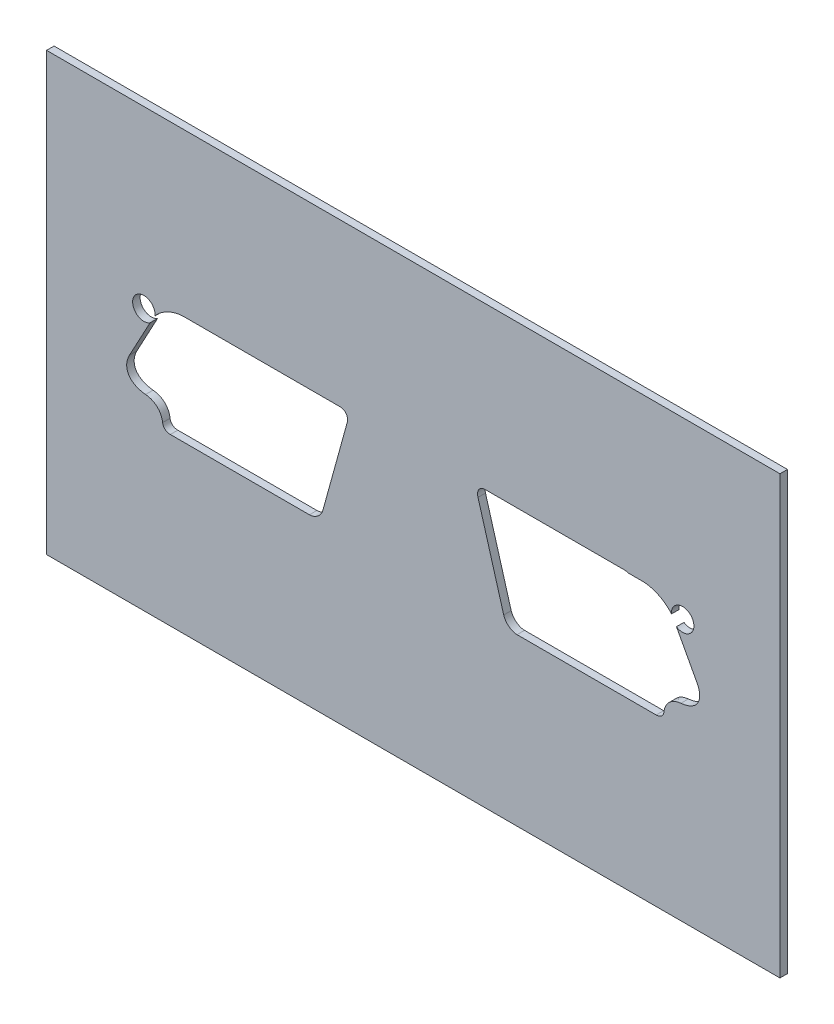
from build123d import *

# Parameters (mm, degrees)
EXTRUDE_1_DEPTH     = 1
CUT_EXTRUDE_4_DEPTH = 54.935146241
SKETCH_4_R          = 1.5
CUT_EXTRUDE_5_DEPTH = 54.935146241
CUT_EXTRUDE1_START  = -1
CUT_EXTRUDE1_DEPTH  = 1
SKETCH4_W           = 98
SKETCH4_H           = 20
BOSS_EXTRUDE1_DEPTH = 1


with BuildPart() as part:
    # Эскиз1 → Бобышка-Вытянуть1 (new body)
    with BuildSketch(Plane.XY):
        Polygon((-49, 5.839183832), (-49, -22.516660498), (49, -22.516660498), (49, 5.839183832), (49, 15.839183832), (-49, 15.839183832), align=None)
    extrude(amount=EXTRUDE_1_DEPTH)

    # Эскиз2 → Вырез-Вытянуть4 (cut, through all)
    with BuildSketch(Plane(origin=(0, 0, 0), x_dir=(-1, 0, 0), z_dir=(0, 0, -1))):
        with BuildLine():
            Line((27.226146034, -9.122134253), (15.739905482, -9.122134253))
            ThreePointArc((15.739905482, -9.122134253), (15.10500819, -9.461530461), (14.917793913, -10.156681647))
            Line((14.917793913, -10.156681647), (17.442090319, -18.930924047))
            ThreePointArc((17.442090319, -18.930924047), (18.050493328, -19.909298147), (19.122649731, -20.331021695))
            Line((19.122649731, -20.331021695), (30.826843589, -20.331021695))
            ThreePointArc((30.826843589, -20.331021695), (31.459345435, -19.990005133), (31.64325008, -19.295361367))
            Line((31.64325008, -19.295361367), (29.100959308, -10.488607797))
            ThreePointArc((29.100959308, -10.488607797), (28.40806584, -9.469896887), (27.226146034, -9.122134253))
        make_face()
        with BuildLine():
            Line((-31.64325008, -19.295361367), (-29.100959308, -10.488607797))
            ThreePointArc((-29.100959308, -10.488607797), (-28.40806584, -9.469896887), (-27.226146034, -9.122134253))
            Line((-27.226146034, -9.122134253), (-15.739905482, -9.122134253))
            ThreePointArc((-15.739905482, -9.122134253), (-15.10500819, -9.461530461), (-14.917793913, -10.156681647))
            Line((-14.917793913, -10.156681647), (-17.442090319, -18.930924047))
            ThreePointArc((-17.442090319, -18.930924047), (-18.050493328, -19.909298147), (-19.122649731, -20.331021695))
            Line((-19.122649731, -20.331021695), (-30.826843589, -20.331021695))
            ThreePointArc((-30.826843589, -20.331021695), (-31.459345435, -19.990005133), (-31.64325008, -19.295361367))
        make_face()
    extrude(amount=-CUT_EXTRUDE_4_DEPTH, mode=Mode.SUBTRACT)

    # Эскиз4 → Вырез-Вытянуть5 (cut, through all)
    with BuildSketch(Plane(origin=(0, 0, 0), x_dir=(-1, 0, 0), z_dir=(0, 0, -1))):
        with Locations((36, -7.524952718)):
            Circle(SKETCH_4_R)
        with Locations((-36, -7.524952718)):
            Circle(SKETCH_4_R)
    extrude(amount=-CUT_EXTRUDE_5_DEPTH, mode=Mode.SUBTRACT)

    # Sketch3 → Cut-Extrude1 (cut)
    with BuildSketch(Plane.XY.offset(1).offset(CUT_EXTRUDE1_START)):
        with BuildLine():
            Line((8.652344227, -7.068131311), (12.085677561, -18.961546856))
            add(Edge.make_bspline(
                [(12.085677561, -18.961546856), (12.485677561, -20.347187502), (13.871318207, -20.347187502)],
                knots=[0.857071948, 0.857071948, 0.857071948, 2.427868275, 2.427868275, 2.427868275], degree=2, weights=[1, 0.707106781, 1]))
            Line((13.871318207, -20.347187502), (32.461996875, -20.347187502))
            add(Edge.make_bspline(
                [(32.461996875, -20.347187502), (33.393769403, -20.347187502), (33.496157418, -19.484255682)],
                knots=[2.427868275, 2.427868275, 2.427868275, 3.611858299, 3.611858299, 3.611858299], degree=2, weights=[1, 0.829829079, 1]))
            add(Edge.make_bspline(
                [(33.496157418, -19.484255682), (33.529743577, -19.201189685), (33.607326061, -18.923570429), (33.853252735, -18.417152493), (34.025349409, -18.183932413), (34.436238564, -17.8036127), (34.681879478, -17.649935655), (35.200024528, -17.435065661), (35.479061866, -17.369439067), (35.76148791, -17.34207634)],
                knots=[0, 0, 0, 0, 0.25, 0.25, 0.5, 0.5, 0.75, 0.75, 1, 1, 1, 1], degree=3))
            add(Edge.make_bspline(
                [(35.76148791, -17.34207634), (36.181169226, -17.301415694), (36.592378309, -17.212108423), (37.170380488, -16.959028015), (37.354968395, -16.854344533), (37.687544868, -16.599797528), (37.83830967, -16.446579579), (38.076557482, -16.101495837), (38.166209489, -15.905573827), (38.271501218, -15.499696694), (38.288800836, -15.285469364), (38.263278752, -14.867475934), (38.220734772, -14.657932914), (38.094284502, -14.258193956), (38.010543981, -14.065974434), (37.910619322, -13.879789794)],
                knots=[0, 0, 0, 0, 0.25, 0.25, 0.375, 0.375, 0.5, 0.5, 0.625, 0.625, 0.75, 0.75, 0.875, 0.875, 1, 1, 1, 1], degree=3))
            Line((37.910619322, -13.879789794), (35.170885606, -8.774980446))
            ThreePointArc((35.170885606, -8.774980446), (34.803783463, -8.429975368), (34.571610551, -7.982886756))
            ThreePointArc((34.571610551, -7.982886756), (34.527886571, -7.812845152), (34.504331156, -7.638859302))
            add(Edge.make_bspline(
                [(34.504331156, -7.638859302), (33.03670289, -5.782259548), (30.630891119, -5.783194379)],
                knots=[4.00651056, 4.00651056, 4.00651056, 5.38030343, 5.38030343, 5.38030343], degree=2, weights=[1, 0.773217832, 1]))
            Line((30.630891119, -5.783194379), (28.778313515, -5.783914238))
            add(Edge.make_bspline(
                [(28.778313515, -5.783914238), (28.498733332, -5.682490665), (28.228663541, -5.682490665)],
                knots=[5.18447533, 5.18447533, 5.18447533, 5.569460928, 5.569460928, 5.569460928], degree=2, weights=[1, 0.981530397, 1]))
            Line((28.228663541, -5.682490665), (9.637984874, -5.682490665))
            add(Edge.make_bspline(
                [(9.637984874, -5.682490665), (8.252344227, -5.682490665), (8.652344227, -7.068131311)],
                knots=[5.569460928, 5.569460928, 5.569460928, 7.140257255, 7.140257255, 7.140257255], degree=2, weights=[1, 0.707106781, 1]))
        make_face()
        with BuildLine():
            Line((-35.170885606, -8.774980446), (-37.925052204, -13.906681863))
            add(Edge.make_bspline(
                [(-37.925052204, -13.906681863), (-38.025225081, -14.093328995), (-38.109806595, -14.28778394), (-38.235924368, -14.687324932), (-38.278394681, -14.895918794), (-38.297414091, -15.212202185), (-38.296322734, -15.317469634), (-38.277441195, -15.527644209), (-38.259343447, -15.633280004), (-38.205994928, -15.836909506), (-38.170798519, -15.935630825), (-38.082894213, -16.126717018), (-38.029532599, -16.219817403), (-37.849055501, -16.479499021), (-37.698892817, -16.631115336), (-37.362837335, -16.886481906), (-37.179664999, -16.989484869), (-36.595923377, -17.242719775), (-36.186794345, -17.329699001), (-35.766265682, -17.369273893)],
                knots=[0, 0, 0, 0, 0.125, 0.125, 0.25, 0.25, 0.3125, 0.3125, 0.375, 0.375, 0.4375, 0.4375, 0.5, 0.5, 0.625, 0.625, 0.75, 0.75, 1, 1, 1, 1], degree=3))
            add(Edge.make_bspline(
                [(-33.495182661, -19.492227082), (-33.738478544, -17.560103824), (-35.766265682, -17.369273893)],
                knots=[5.81913938, 5.81913938, 5.81913938, 6.905546226, 6.905546226, 6.905546226], degree=2, weights=[1, 0.856057288, 1]))
            add(Edge.make_bspline(
                [(-33.495182661, -19.492227082), (-33.387524752, -20.347187502), (-32.461996875, -20.347187502)],
                knots=[2.677546726, 2.677546726, 2.677546726, 3.855317033, 3.855317033, 3.855317033], degree=2, weights=[1, 0.83156042, 1]))
            Line((-32.461996875, -20.347187502), (-13.871318207, -20.347187502))
            add(Edge.make_bspline(
                [(-13.871318207, -20.347187502), (-12.46794332, -20.347187502), (-12.080702928, -18.943926093)],
                knots=[3.855317033, 3.855317033, 3.855317033, 5.438830393, 5.438830393, 5.438830393], degree=2, weights=[1, 0.702596367, 1]))
            Line((-12.080702928, -18.943926093), (-8.83075434, -7.166932971))
            add(Edge.make_bspline(
                [(-8.83075434, -7.166932971), (-8.45309236, -5.798381309), (-9.82190813, -5.798913193)],
                knots=[5.438830393, 5.438830393, 5.438830393, 6.997298301, 6.997298301, 6.997298301], degree=2, weights=[1, 0.711452073, 1]))
            Line((-9.82190813, -5.798913193), (-30.645016113, -5.807004464))
            add(Edge.make_bspline(
                [(-30.645016113, -5.807004464), (-33.032902471, -5.807932329), (-34.505069218, -7.648167801)],
                knots=[0.90305787, 0.90305787, 0.90305787, 2.269113721, 2.269113721, 2.269113721], degree=2, weights=[1, 0.775665219, 1]))
            ThreePointArc((-34.505069218, -7.648167801), (-34.53118454, -7.829224215), (-34.579145022, -8.005755309))
            ThreePointArc((-34.579145022, -8.005755309), (-34.811085633, -8.43954696), (-35.170885606, -8.774980446))
        make_face()
    extrude(amount=CUT_EXTRUDE1_DEPTH, mode=Mode.SUBTRACT)

    # Sketch4 → Boss-Extrude1 (add)
    with BuildSketch(Plane.XY.offset(1)):
        with Locations((0, -32.516660498)):
            Rectangle(SKETCH4_W, SKETCH4_H)
    extrude(amount=-BOSS_EXTRUDE1_DEPTH)


solid = part.part
